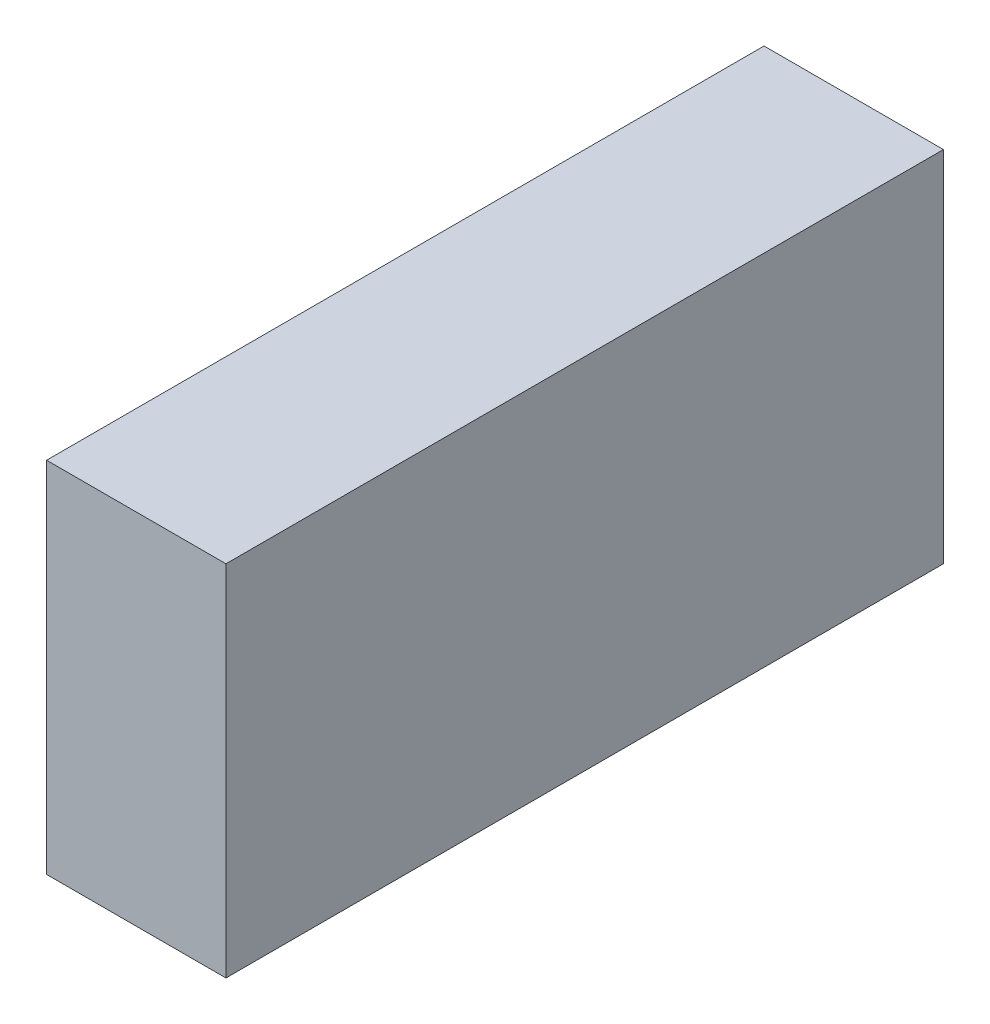
from build123d import *

# Parameters (mm, degrees)
SKETCH1_W           = 6.35
SKETCH1_H           = 12.7
BOSS_EXTRUDE1_DEPTH = 12.7


with BuildPart() as part:
    # Sketch1 → Boss-Extrude1 (new, symmetric)
    with BuildSketch(Plane.XY):
        with Locations((0, 15.875)):
            Rectangle(SKETCH1_W, SKETCH1_H)
    extrude(amount=BOSS_EXTRUDE1_DEPTH, both=True)


solid = part.part
